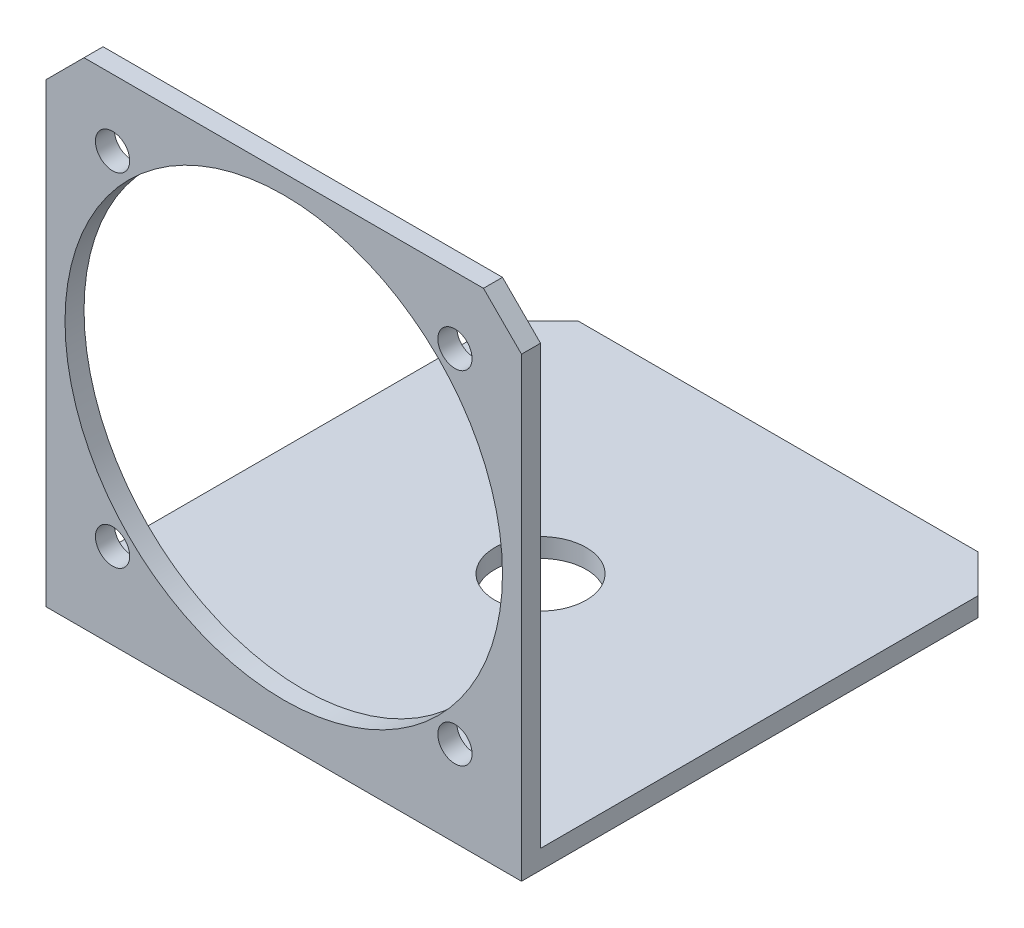
from build123d import *

# Parameters (mm, degrees)
SKETCH1_W           = 31.75
SKETCH1_H           = 31.75
SKETCH1_R           = 1.143
SKETCH1_R_2         = 14.605
BOSS_EXTRUDE1_DEPTH = 1.27
CHAMFER1_SIZE       = 2.54
SKETCH2_W           = 31.75
SKETCH2_H           = 33.02
BOSS_EXTRUDE2_DEPTH = 1.27
SKETCH3_R           = 3.048
CUT_EXTRUDE1_DEPTH  = 1.27
CHAMFER2_SIZE       = 2.54


with BuildPart() as part:
    # Sketch1 → Boss-Extrude1 (new body)
    with BuildSketch(Plane.XY):
        Rectangle(SKETCH1_W, SKETCH1_H)
        with Locations((-11.43, 11.43)):
            Circle(SKETCH1_R, mode=Mode.SUBTRACT)
        with Locations((11.43, 11.43)):
            Circle(SKETCH1_R, mode=Mode.SUBTRACT)
        with Locations((-11.43, -11.43)):
            Circle(SKETCH1_R, mode=Mode.SUBTRACT)
        with Locations((11.43, -11.43)):
            Circle(SKETCH1_R, mode=Mode.SUBTRACT)
        Circle(SKETCH1_R_2, mode=Mode.SUBTRACT)
    extrude(amount=BOSS_EXTRUDE1_DEPTH)

    # Chamfer1
    chamfer1_edges = [part.edges().sort_by_distance(p)[0] for p in [
        (-15.875, 15.875, 0.635),
        (15.875, 15.875, 0.635),
    ]]
    chamfer(chamfer1_edges, length=CHAMFER1_SIZE)

    # Sketch2 → Boss-Extrude2 (add)
    with BuildSketch(Plane.XZ.offset(15.875)):
        with Locations((0, -15.24)):
            Rectangle(SKETCH2_W, SKETCH2_H)
    extrude(amount=BOSS_EXTRUDE2_DEPTH)

    # Sketch3 → Cut-Extrude1 (cut)
    with BuildSketch(Plane(origin=(0, -15.875, 0), x_dir=(1, 0, 0), z_dir=(0, 1, 0))):
        with Locations(Location((0, 15.875, 0), (0, 0, 270))):
            Circle(SKETCH3_R)
    extrude(amount=-CUT_EXTRUDE1_DEPTH, mode=Mode.SUBTRACT)

    # Chamfer2
    chamfer2_edges = [part.edges().sort_by_distance(p)[0] for p in [
        (15.875, -16.51, -31.75),
        (-15.875, -16.51, -31.75),
    ]]
    chamfer(chamfer2_edges, length=CHAMFER2_SIZE)


solid = part.part
